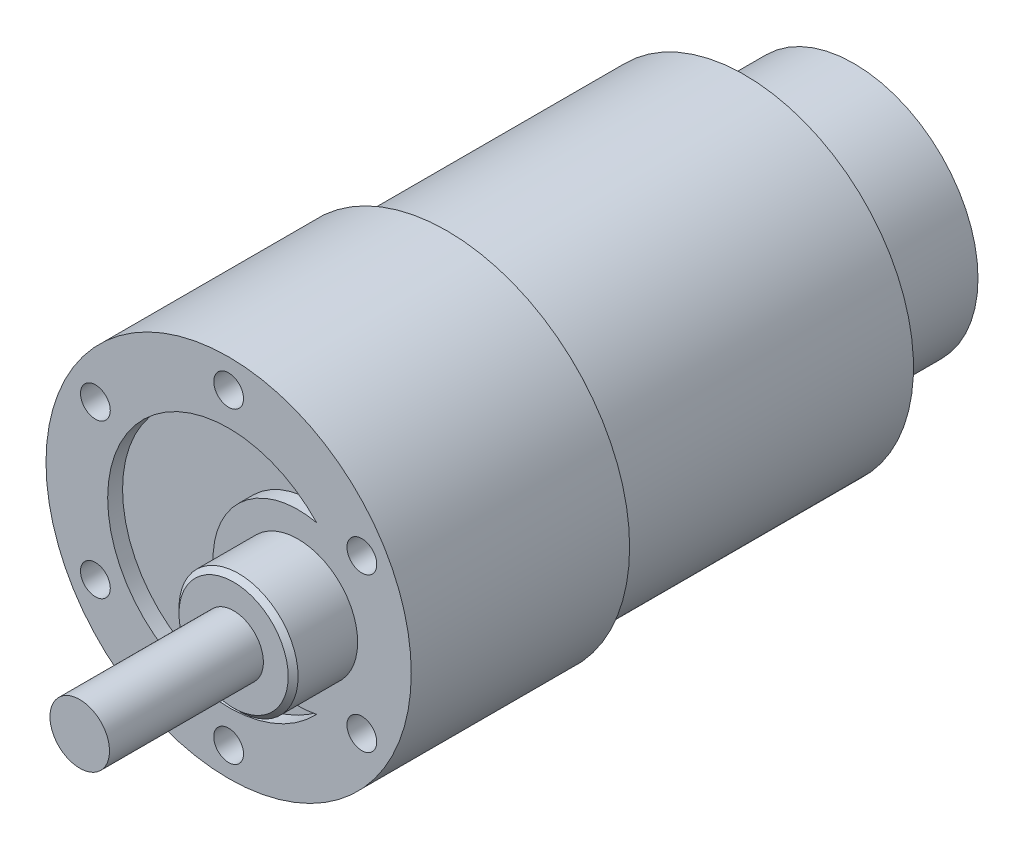
from build123d import *

# Parameters (mm, degrees)
SKETCH2_R                    = 17
BOSS_EXTRUDE1_DEPTH          = 29
SKETCH3_R                    = 12.5
BOSS_EXTRUDE2_DEPTH          = 11
CUT_EXTRUDE1_DEPTH           = 1.5
F_3_0_3_DIAMETER_HOLE1_D     = 3
F_3_0_3_DIAMETER_HOLE1_DEPTH = 3
CHAMFER1_SIZE                = 0.5


with BuildPart() as part:
    # Sketch1 → Revolve1 (revolve)
    with BuildSketch(Plane.XZ, mode=Mode.PRIVATE) as revolve1_sk:
        with BuildLine():
            Line((18.4, 52), (0, 52))
            Line((0, 52), (0, 29))
            Line((0, 29), (17, 29))
            ThreePointArc((17, 29), (16.707106781, 29.707106781), (16, 30))
            Line((16, 30), (18.4, 30))
            Line((18.4, 30), (18.4, 52))
        make_face()
    revolve(revolve1_sk.sketch.rotate(Axis((0, 0, 52), (0, 0, -1)), 180), axis=Axis((0, 0, 52), (0, 0, -1)))

    # Sketch2 → Boss-Extrude1 (add)
    with BuildSketch(Plane(origin=(0, 0, 29), x_dir=(-1, 0, 0), z_dir=(0, 0, -1))):
        Circle(SKETCH2_R)
    extrude(amount=BOSS_EXTRUDE1_DEPTH)

    # Sketch3 → Boss-Extrude2 (add)
    with BuildSketch(Plane(origin=(0, 0, 0), x_dir=(-1, 0, 0), z_dir=(0, 0, -1))):
        Circle(SKETCH3_R)
    extrude(amount=BOSS_EXTRUDE2_DEPTH)

    # Sketch4 → Cut-Extrude1 (cut)
    with BuildSketch(Plane.XY.offset(52)):
        with BuildLine():
            ThreePointArc((8.868134735, 8.359715213), (-12.187233161, 0), (8.868134735, -8.359715213))
            ThreePointArc((8.868134735, -8.359715213), (-1.565907181, 0), (8.868134735, 8.359715213))
        make_face()
    extrude(amount=-CUT_EXTRUDE1_DEPTH, mode=Mode.SUBTRACT)

    # Sketch5 → Revolve2 (revolve)
    with BuildSketch(Plane.XZ, mode=Mode.PRIVATE) as revolve2_sk:
        Polygon((10, 74), (7, 74), (7, 52), (13, 52), (13, 58.5), (10, 58.5), align=None)
    revolve(revolve2_sk.sketch.rotate(Axis((7, 0, 74), (0, 0, -1)), 180), axis=Axis((7, 0, 74), (0, 0, -1)))

    # Ø3.0 (3) Diameter Hole1
    with Locations(Plane.XY.offset(52)):
        with Locations((-13.423393759, 7.75), (-13.423393759, -7.75), (0, -15.5), (13.423393759, -7.75), (13.423393759, 7.75), (0, 15.5)):
            Hole(F_3_0_3_DIAMETER_HOLE1_D / 2, depth=F_3_0_3_DIAMETER_HOLE1_DEPTH)

    # Chamfer1
    chamfer1_edges = [part.edges().sort_by_distance(p)[0] for p in [
        (13, 0, 58.5),
    ]]
    chamfer(chamfer1_edges, length=CHAMFER1_SIZE)


solid = part.part
